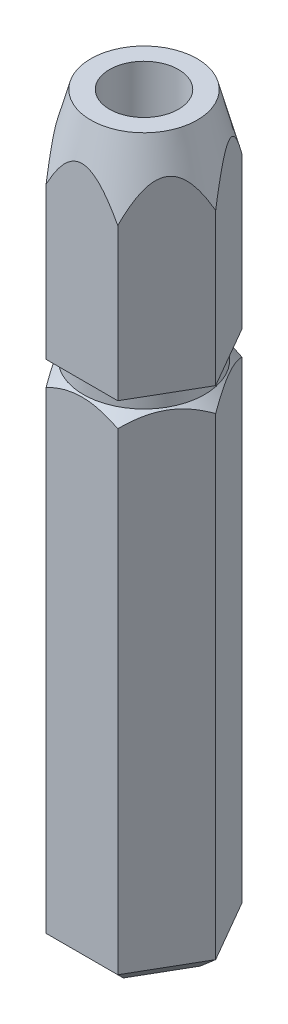
from build123d import *

# Parameters (mm, degrees)
EXTRUDE1_DEPTH     = 84.1375
SKETCH4_R          = 3.96875
CUT_EXTRUDE1_DEPTH = 85.842184608
CHAMFER1_SIZE      = 1.524


with BuildPart() as part:
    # Sketch1 → Extrude1 (new body)
    with BuildSketch(Plane(origin=(0, 0, 0), x_dir=(1, 0, 0), z_dir=(0, 1, 0))):
        Polygon((4.124445986, -7.14375), (8.248891971, 0), (4.124445986, 7.14375), (-4.124445986, 7.14375), (-8.248891971, 0), (-4.124445986, -7.14375), align=None)
    extrude(amount=EXTRUDE1_DEPTH)

    # Sketch4 → Cut-Extrude1 (cut, through all)
    with BuildSketch(Plane(origin=(0, 84.1375, 0), x_dir=(-1, 0, 0), z_dir=(0, 1, 0))):
        with Locations(Location((0, 0, 0), (0, 0, 90))):
            Circle(SKETCH4_R)
    extrude(amount=-CUT_EXTRUDE1_DEPTH, mode=Mode.SUBTRACT)

    # Sketch2 → Cut-Revolve1 (revolve, cut)
    with BuildSketch(Plane(origin=(0, 0, 0), x_dir=(-0.500000000000001, 0, -0.866025403784438), z_dir=(0.866025403784438, 0, -0.500000000000001)), mode=Mode.PRIVATE) as cut_revolve1_sk:
        Polygon((8.248891971, 84.1375), (8.248891971, 76.2), (6.122045256, 84.1375), align=None)
    revolve(cut_revolve1_sk.sketch.rotate(Axis((0, -6.288333001, 0), (0, 1, 0)), 330), axis=Axis((0, -6.288333001, 0), (0, 1, 0)), mode=Mode.SUBTRACT)

    # Sketch3 → Cut-Revolve2 (revolve, cut)
    with BuildSketch(Plane(origin=(0, 0, 0), x_dir=(-0.500000000000001, 0, -0.866025403784438), z_dir=(0.866025403784438, 0, -0.500000000000001)), mode=Mode.PRIVATE) as cut_revolve2_sk:
        Polygon((8.248891971, 55.949608029), (6.985, 57.2135), (6.985, 58.7375), (8.248891971, 58.7375), align=None)
    revolve(cut_revolve2_sk.sketch.rotate(Axis((0, -5.572817584, 0), (0, 1, 0)), 330), axis=Axis((0, -5.572817584, 0), (0, 1, 0)), mode=Mode.SUBTRACT)

    # Chamfer1
    chamfer1_edges = [part.edges().sort_by_distance(p)[0] for p in [
        (0, 0, -3.96875),
        (-6.186668978, 0, 3.571875),
        (-6.186668978, 0, -3.571875),
        (0, 0, -7.14375),
        (6.186668978, 0, -3.571875),
        (6.186668978, 0, 3.571875),
        (0, 0, 7.14375),
    ]]
    chamfer(chamfer1_edges, length=CHAMFER1_SIZE)


solid = part.part
